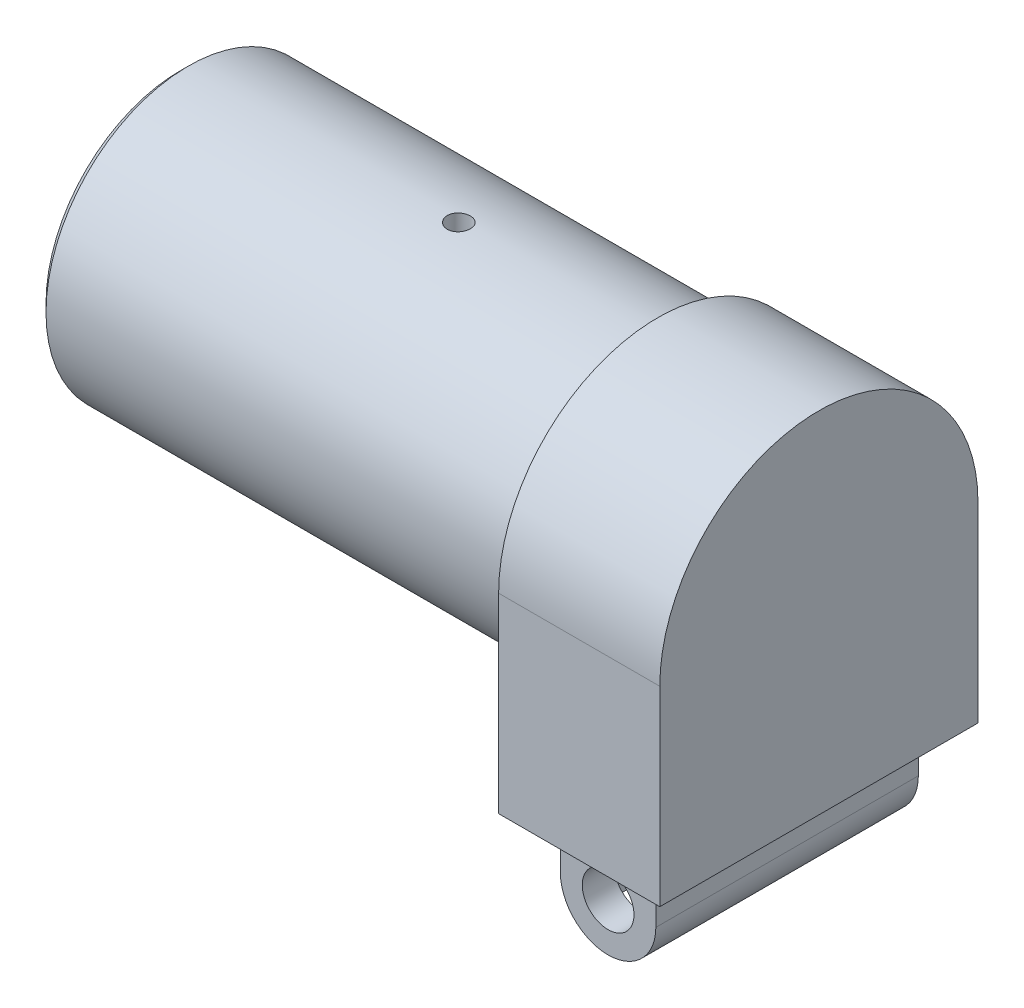
from build123d import *

# Parameters (mm, degrees)
EXTRUDE_1_DEPTH      = 10
EXTRUDE_1_DEPTH_BACK = 10.26
SKETCH_4_R           = 17.9
EXTRUDE_3_DEPTH      = 60
EXTRUDE_7_DEPTH      = 16.5
EXTRUDE_7_DEPTH_BACK = 16.5
SKETCH_15_R          = 6
SKETCH_17_R          = 3.25
CUT_EXTRUDE_3_DEPTH  = 13
CUT_EXTRUDE_4_DEPTH  = 1.95
FILLET_1_R           = 3
HOLE_WIZARD_M2_5_1_D = 2.9
CHAMFER_1_SIZE       = 1


with BuildPart() as part:
    # 스케치1 → 보스-돌출1 (new, two sides: drawn at the far end of the back side and taken through both)
    with BuildSketch(Plane(origin=(0, 0, 0), x_dir=(0, 0, -1), z_dir=(1, 0, 0)).offset(-EXTRUDE_1_DEPTH_BACK)):
        with BuildLine():
            Line((20, -24), (20, 0))
            ThreePointArc((20, 0), (0, 20), (-20, 0))
            Line((-20, 0), (-20, -24))
            Line((-20, -24), (20, -24))
        make_face()
    extrude(amount=EXTRUDE_1_DEPTH + EXTRUDE_1_DEPTH_BACK)

    # 스케치4 → 보스-돌출3 (add)
    with BuildSketch(Plane.ZY.offset(10.26)):
        Circle(SKETCH_4_R)
    extrude(amount=EXTRUDE_3_DEPTH)

    # 스케치15 → 보스-돌출7 (add, two sides: drawn at the far end of the back side and taken through both)
    with BuildSketch(Plane.XY.offset(-EXTRUDE_7_DEPTH_BACK)):
        with BuildLine():
            Line((-6, -24), (-6, -30))
            ThreePointArc((-6, -30), (-4.242640687, -25.757359313), (0, -24))
            Line((0, -24), (-6, -24))
        make_face()
        with Locations((0, -30)):
            Circle(SKETCH_15_R)
        with BuildLine():
            ThreePointArc((0, -24), (4.242640687, -25.757359313), (6, -30))
            Line((6, -30), (6, -24))
            Line((6, -24), (0, -24))
        make_face()
    extrude(amount=EXTRUDE_7_DEPTH + EXTRUDE_7_DEPTH_BACK)

    # 스케치17 → 컷-돌출3 (cut)
    with BuildSketch(Plane(origin=(0, 0, -16.5), x_dir=(-1, 0, 0), z_dir=(0, 0, -1))):
        with Locations((0, -30)):
            Circle(SKETCH_17_R)
    cut_extrude_3 = extrude(amount=-CUT_EXTRUDE_3_DEPTH, mode=Mode.SUBTRACT)

    # 대칭 복사7: 컷-돌출3 across plane
    add(cut_extrude_3.mirror(Plane.XY), mode=Mode.SUBTRACT)

    # 스케치18 → 컷-돌출4 (cut, symmetric)
    with BuildSketch(Plane(origin=(0, 0, -10.5), x_dir=(-1, 0, 0), z_dir=(0, 0, -1))):
        Polygon((-4.2, -36), (4.2, -36), (4.2, -32.424871131), (0, -34.849742261), (-4.2, -32.424871131), align=None)
        Polygon((-4.2, -27.575128869), (-4.2, -32.424871131), (0, -34.849742261), (4.2, -32.424871131), (4.2, -27.575128869), (0, -25.150257739), align=None)
    cut_extrude_4 = extrude(amount=CUT_EXTRUDE_4_DEPTH, both=True, mode=Mode.SUBTRACT)

    # 대칭 복사8: 컷-돌출4 across plane
    add(cut_extrude_4.mirror(Plane.XY), mode=Mode.SUBTRACT)

    # 필렛1
    fillet_1_edges = [part.edges().sort_by_distance(p)[0] for p in [
        (-6, -24, 0),
        (6, -24, 0),
    ]]
    fillet(fillet_1_edges, radius=FILLET_1_R)

    # M2.5 여유 구멍1 (through all)
    with Locations(Plane(origin=(0, 17.9, 0), x_dir=(1, 0, 0), z_dir=(0, 1, 0))):
        with Locations((-35.26, 0)):
            Hole(HOLE_WIZARD_M2_5_1_D / 2)

    # 모따기1
    chamfer_1_edges = [part.edges().sort_by_distance(p)[0] for p in [
        (-70.26, 0, -17.9),
    ]]
    chamfer(chamfer_1_edges, length=CHAMFER_1_SIZE)


solid = part.part
